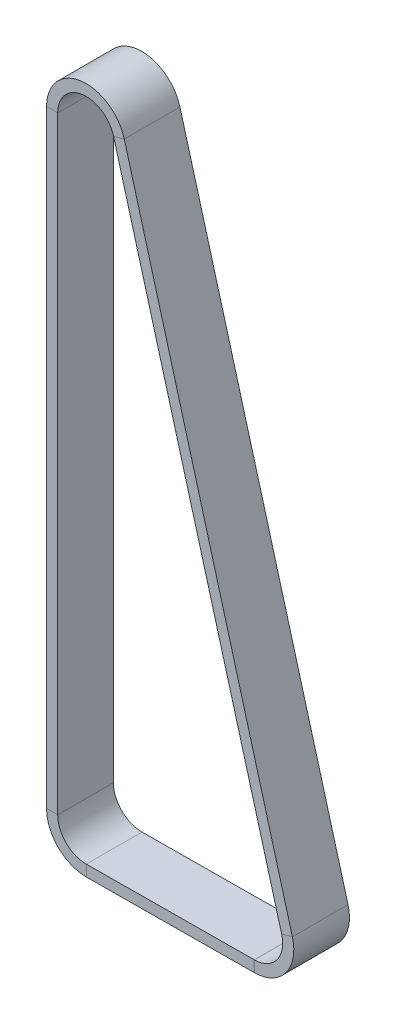
from build123d import *

# Parameters (mm, degrees)
SKETCH3_W = 10
SKETCH3_H = 2


with BuildPart() as part:
    # Sweep1: sweep along a path in Sketch2
    with BuildLine(Plane.XY) as sweep1_path:
        Line((0.041437713, -6.112062636), (-30.163340444, -6.316840793))
        ThreePointArc((-30.163340444, -6.316840793), (-34.512083059, -4.541384115), (-36.316981258, -0.204778157))
        Line((-36.316981258, -0.204778157), (-36.316981258, 109.034485953))
        ThreePointArc((-36.316981258, 109.034485953), (-31.028159158, 115.0909759), (-24.314412014, 110.666237605))
        Line((-24.314412014, 110.666237605), (5.890366142, 1.631751652))
        ThreePointArc((5.890366142, 1.631751652), (4.877318851, -3.683854988), (0.041437713, -6.112062636))
    # Sketch3 → Sweep1 (sweep)
    with BuildSketch(Plane(origin=(0, 0, 0), x_dir=(0, 0, -1), z_dir=(1, 0, 0))):
        with Locations((0, -6.112062636)):
            Rectangle(SKETCH3_W, SKETCH3_H)
    sweep(path=sweep1_path.line)


solid = part.part
